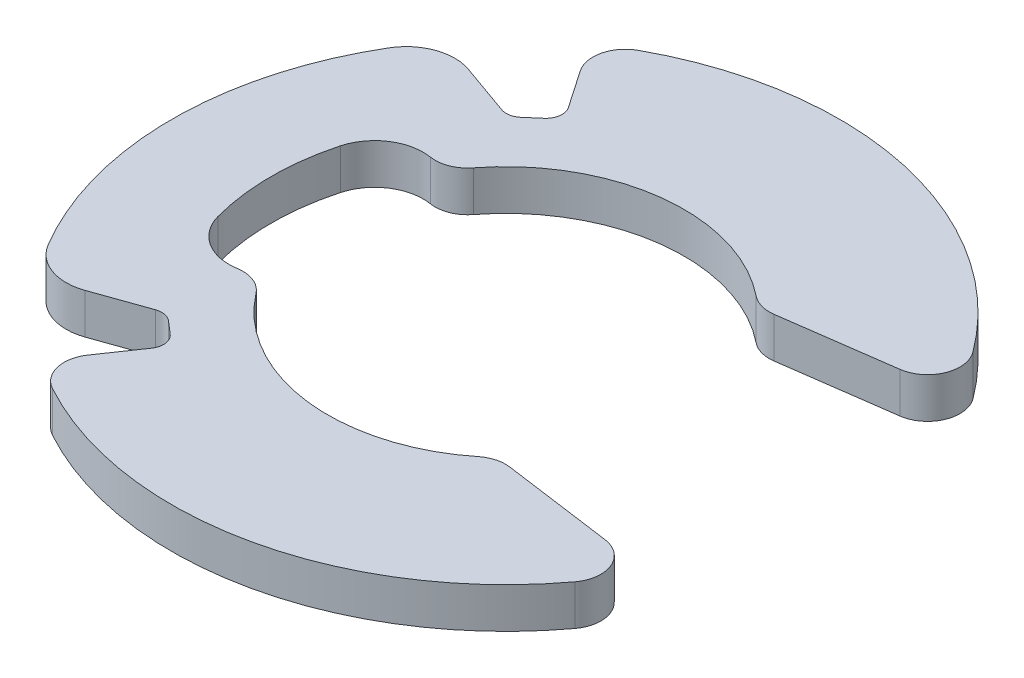
from build123d import *

# Parameters (mm, degrees)
EXTRUDE1_DEPTH = 0.635


with BuildPart() as part:
    # Sketch1 → Extrude1 (new, symmetric)
    with BuildSketch(Plane(origin=(0, 0, 0), x_dir=(1, 0, 0), z_dir=(0, 1, 0))):
        with BuildLine():
            Line((-10.4775, 0), (-7.366, 0))
            ThreePointArc((-7.366, 0), (-7.301957926, 0.969209186), (-7.110945304, 1.921565217))
            ThreePointArc((-7.110945304, 1.921565217), (-6.465513716, 2.804871922), (-5.394551993, 3.02815125))
            ThreePointArc((-5.394551993, 3.02815125), (-4.857704937, 3.086024688), (-4.426323701, 3.410777403))
            ThreePointArc((-4.426323701, 3.410777403), (-0.665227036, 5.54826252), (3.494563676, 4.360478037))
            ThreePointArc((3.494563676, 4.360478037), (3.859883441, 4.17384031), (4.269231255, 4.146885928))
            Line((4.269231255, 4.146885928), (7.740657974, 4.627351162))
            ThreePointArc((7.740657974, 4.627351162), (8.538061077, 5.240237956), (8.417619634, 6.238724705))
            ThreePointArc((8.417619634, 6.238724705), (2.243656673, 10.234452158), (-5.035674849, 9.188034886))
            ThreePointArc((-5.035674849, 9.188034886), (-5.535533941, 8.533256201), (-5.38578247, 7.723213774))
            Line((-5.38578247, 7.723213774), (-4.574680298, 6.538185302))
            ThreePointArc((-4.574680298, 6.538185302), (-4.490147686, 6.185607258), (-4.662218923, 5.866470095))
            Line((-4.662218923, 5.866470095), (-5.056506744, 5.526610046))
            ThreePointArc((-5.056506744, 5.526610046), (-5.294597853, 5.412088501), (-5.558000453, 5.432622154))
            Line((-5.558000453, 5.432622154), (-7.187368065, 6.010571783))
            ThreePointArc((-7.187368065, 6.010571783), (-8.214915896, 6.007492148), (-9.006942583, 5.35284892))
            ThreePointArc((-9.006942583, 5.35284892), (-10.103173936, 2.775586905), (-10.4775, 0))
        make_face()
    extrude(amount=EXTRUDE1_DEPTH, both=True)

    # Mirror1: part across plane


with BuildPart() as part_1:
    add(part.part)
    add(part.part.mirror(Plane(origin=(-10.4775, 0.635, 0), x_dir=(1, 0, 0), z_dir=(0, 0, -1))))


solid = part_1.part
